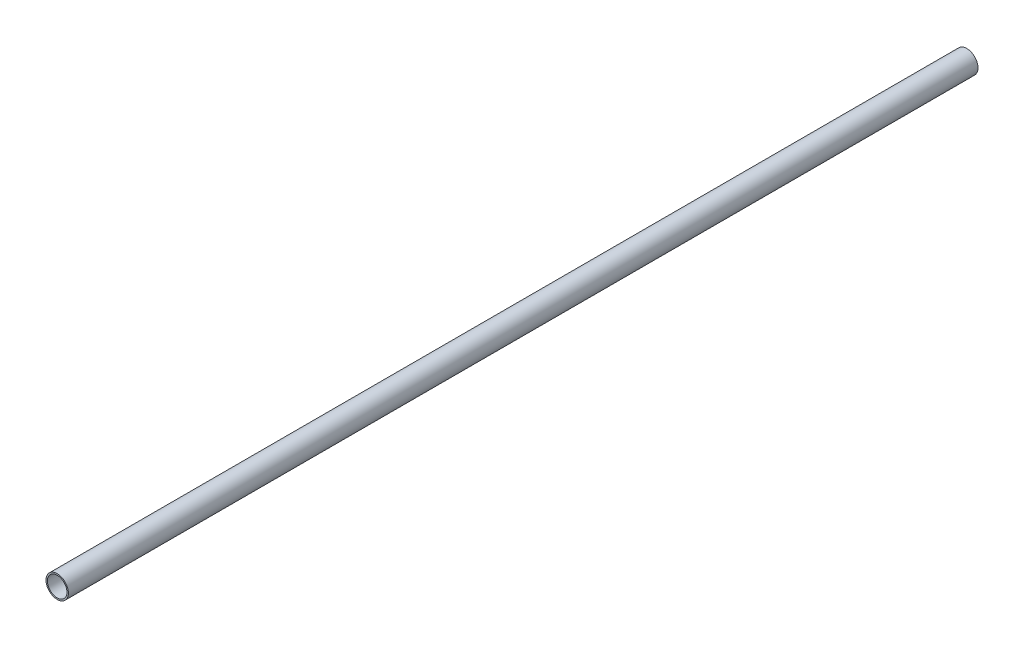
from build123d import *

# Parameters (mm, degrees)
SKETCH_1_R      = 8
SKETCH_1_R_2    = 7
EXTRUDE_1_DEPTH = 325


with BuildPart() as part:
    # Эскиз1 → Бобышка-Вытянуть1 (new, symmetric)
    with BuildSketch(Plane.XY):
        Circle(SKETCH_1_R)
        Circle(SKETCH_1_R_2, mode=Mode.SUBTRACT)
    extrude(amount=EXTRUDE_1_DEPTH, both=True)


solid = part.part
